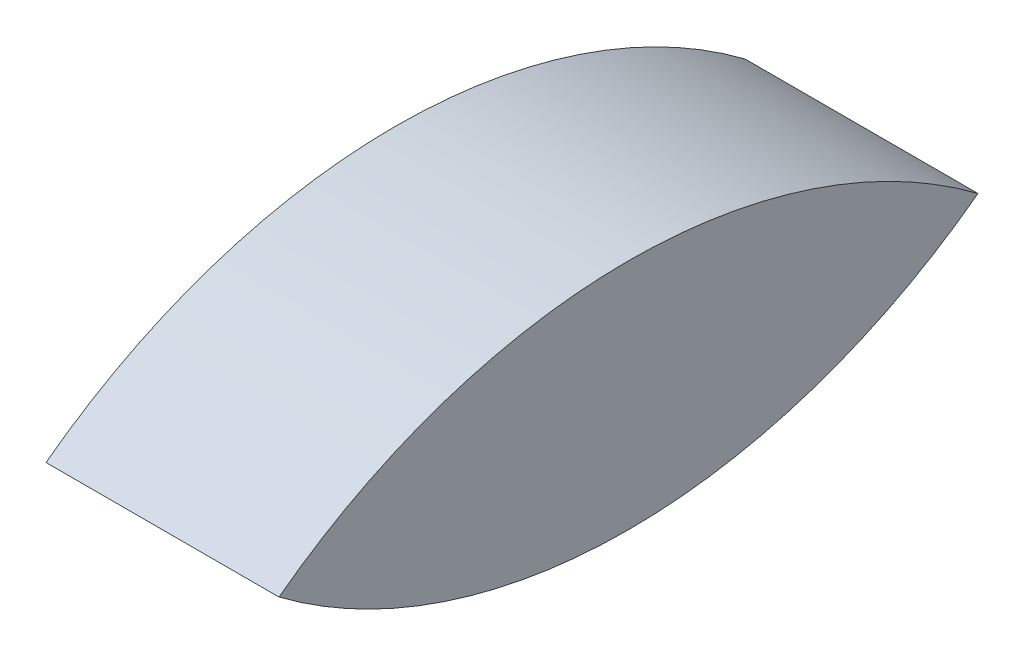
from build123d import *

# Parameters (mm, degrees)
EXTRUDE_1_DEPTH = 5


with BuildPart() as part:
    # Эскиз3 → Бобышка-Вытянуть1 (new, symmetric)
    with BuildSketch(Plane(origin=(0, 0, 0), x_dir=(0, 0, -1), z_dir=(1, 0, 0))):
        with BuildLine():
            ThreePointArc((0, 0), (15, 5), (30, 0))
            ThreePointArc((30, 0), (15, -5), (0, 0))
        make_face()
    extrude(amount=EXTRUDE_1_DEPTH, both=True)


solid = part.part
